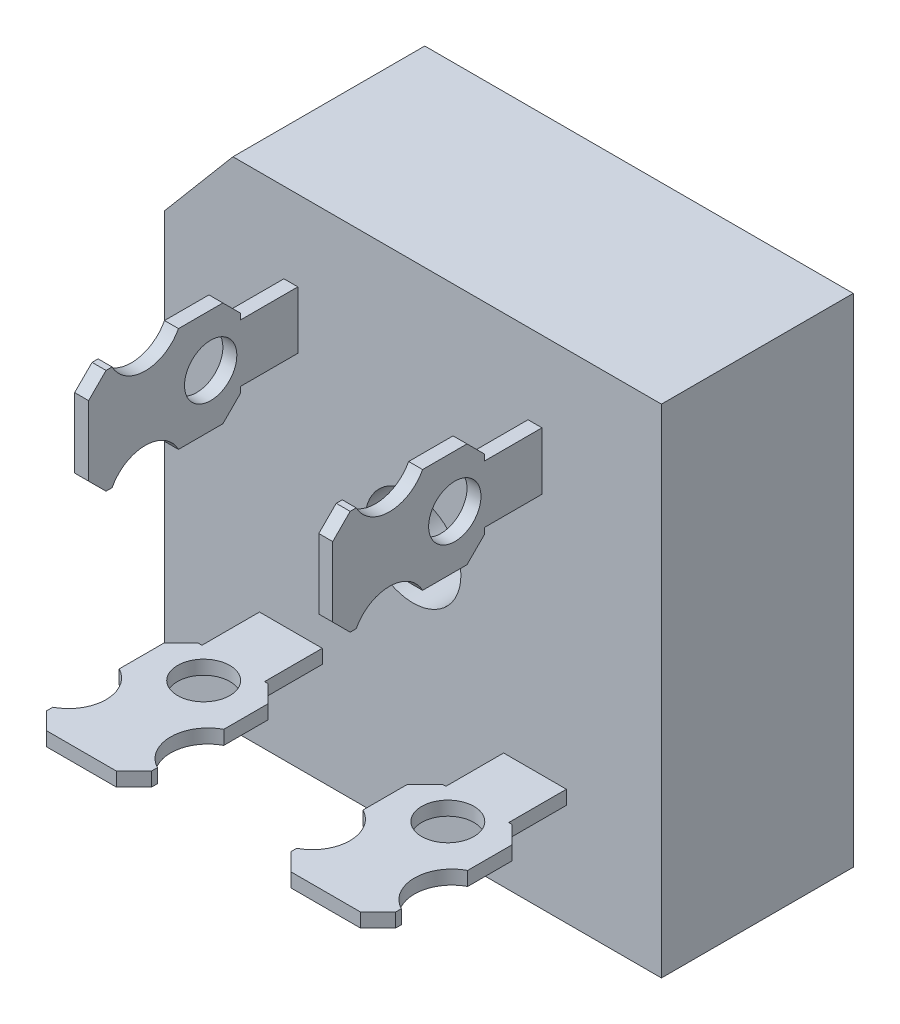
from build123d import *

# Parameters (mm, degrees)
SKETCH_1_W          = 28.5
SKETCH_1_H          = 28.5
SKETCH_1_R          = 2.75
EXTRUDE_1_DEPTH     = 11
SKETCH_2_W          = 6
SKETCH_2_H          = 0.8
SKETCH_2_W_2        = 0.8
SKETCH_2_H_2        = 6
EXTRUDE_2_DEPTH     = 12
SKETCH_3_R          = 1.5
SKETCH_3_R_2        = 2.15
SKETCH_3_W          = 1.2
SKETCH_3_H          = 3.3
SKETCH_3_H_2        = 3.309090331
CUT_EXTRUDE_1_DEPTH = 2
SKETCH_4_R          = 1.5
SKETCH_4_R_2        = 2.15
SKETCH_4_W          = 3.3
SKETCH_4_H          = 1.35
CUT_EXTRUDE_2_DEPTH = 20
CHAMFER_1_SIZE      = 1
CUT_EXTRUDE_3_DEPTH = 15


with BuildPart() as part:
    # Эскиз1 → Вытянуть1 (new body)
    with BuildSketch(Plane.XY):
        with Locations((14.25, 14.25)):
            Rectangle(SKETCH_1_W, SKETCH_1_H)
        with Locations((14.25, 14.25)):
            Circle(SKETCH_1_R, mode=Mode.SUBTRACT)
    extrude(amount=EXTRUDE_1_DEPTH)

    # Эскиз2 → Вытянуть2 (add)
    with BuildSketch(Plane.XY.offset(11)):
        with Locations((7.25, 6.25)):
            Rectangle(SKETCH_2_W, SKETCH_2_H)
        with Locations((21.25, 6.25)):
            Rectangle(SKETCH_2_W, SKETCH_2_H)
        with Locations((21.25, 22.25)):
            Rectangle(SKETCH_2_W_2, SKETCH_2_H_2)
        with Locations((7.25, 22.25)):
            Rectangle(SKETCH_2_W_2, SKETCH_2_H_2)
    extrude(amount=EXTRUDE_2_DEPTH)

    # Эскиз3 → Вырез-Вытянуть1 (cut)
    with BuildSketch(Plane.XZ.offset(-5.85)):
        with Locations((7.25, 16)):
            Circle(SKETCH_3_R)
        with Locations((21.25, 16)):
            Circle(SKETCH_3_R)
        with Locations((3.25, 19.75)):
            Circle(SKETCH_3_R_2)
        with Locations((11.25, 19.75)):
            Circle(SKETCH_3_R_2)
        with Locations((17.25, 19.764625166)):
            Circle(SKETCH_3_R_2)
        with Locations((25.25, 19.764625166)):
            Circle(SKETCH_3_R_2)
        with Locations((4.85, 12.65)):
            Rectangle(SKETCH_3_W, SKETCH_3_H)
        with Locations((9.65, 12.654545166)):
            Rectangle(SKETCH_3_W, SKETCH_3_H_2)
        with Locations((18.85, 12.654545166)):
            Rectangle(SKETCH_3_W, SKETCH_3_H_2)
        with Locations((23.65, 12.654545166)):
            Rectangle(SKETCH_3_W, SKETCH_3_H_2)
    extrude(amount=-CUT_EXTRUDE_1_DEPTH, mode=Mode.SUBTRACT)

    # Эскиз4 → Вырез-Вытянуть2 (cut)
    with BuildSketch(Plane.ZY.offset(-6.85)):
        with Locations(Location((16, 22.25, 0), (0, 0, 270))):
            Circle(SKETCH_4_R)
        with Locations((19.75, 18.25)):
            Circle(SKETCH_4_R_2)
        with Locations((19.75, 26.25)):
            Circle(SKETCH_4_R_2)
        with Locations((12.65, 24.575)):
            Rectangle(SKETCH_4_W, SKETCH_4_H)
        with Locations((12.65, 19.925)):
            Rectangle(SKETCH_4_W, SKETCH_4_H)
    extrude(amount=-CUT_EXTRUDE_2_DEPTH, mode=Mode.SUBTRACT)

    # Фаска1
    chamfer_1_edges = [part.edges().sort_by_distance(p)[0] for p in [
        (4.25, 6.25, 14.3),
        (4.25, 6.25, 23),
        (10.25, 6.25, 23),
        (10.25, 6.25, 14.309090331),
        (18.25, 6.25, 14.309090331),
        (18.25, 6.25, 23),
        (24.25, 6.25, 23),
        (24.25, 6.25, 14.309090331),
        (21.25, 25.25, 14.3),
        (21.25, 19.25, 14.3),
        (21.25, 19.25, 23),
        (21.25, 25.25, 23),
        (7.25, 25.25, 14.3),
        (7.25, 19.25, 14.3),
        (7.25, 19.25, 23),
        (7.25, 25.25, 23),
    ]]
    chamfer(chamfer_1_edges, length=CHAMFER_1_SIZE)

    # Эскиз5 → Вырез-Вытянуть3 (cut)
    with BuildSketch(Plane.XY.offset(11)):
        Polygon((3.927388562, 28.5), (0, 28.5), (0, 23.850233168), align=None)
    extrude(amount=-CUT_EXTRUDE_3_DEPTH, mode=Mode.SUBTRACT)


solid = part.part
